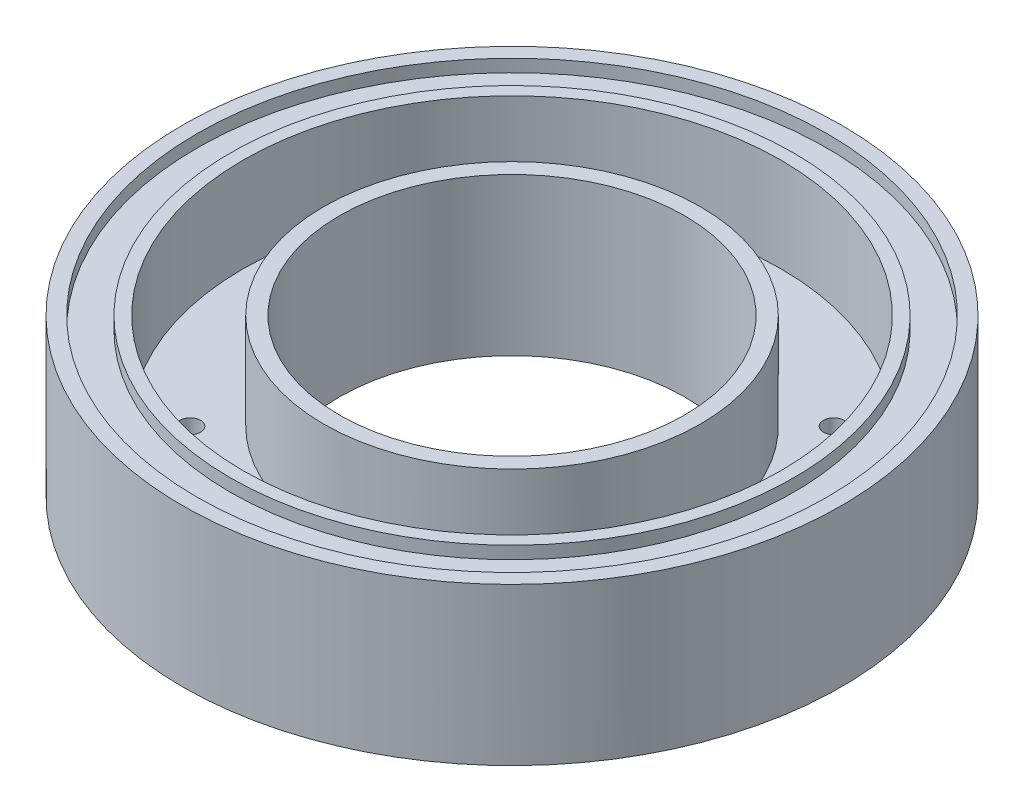
from build123d import *

# Parameters (mm, degrees)
SKETCH1_R           = 52.5
BOSS_EXTRUDE1_DEPTH = 30
SKETCH2_R           = 50.175
SKETCH2_R_2         = 44.85
CUT_EXTRUDE1_DEPTH  = 7
SKETCH3_R           = 42.85
SKETCH3_R_2         = 30
CUT_EXTRUDE2_DEPTH  = 20
SKETCH6_R           = 27.5
CUT_EXTRUDE6_DEPTH  = 81.07808689
SKETCH9_R           = 1.65
CUT_EXTRUDE7_DEPTH  = 10
SKETCH10_R          = 3
CUT_EXTRUDE8_DEPTH  = 4
SKETCH12_W          = 130.559751652
SKETCH12_H          = 125.592804578
CUT_EXTRUDE9_DEPTH  = 5
SKETCH13_R          = 43.441303223
SKETCH13_R_2        = 30
CUT_EXTRUDE10_DEPTH = 0.3


with BuildPart() as part:
    # Sketch1 → Boss-Extrude1 (new body)
    with BuildSketch(Plane(origin=(0, 0, 0), x_dir=(1, 0, 0), z_dir=(0, 1, 0))):
        Circle(SKETCH1_R)
    extrude(amount=BOSS_EXTRUDE1_DEPTH)

    # Sketch2 → Cut-Extrude1 (cut)
    with BuildSketch(Plane(origin=(0, 30, 0), x_dir=(1, 0, 0), z_dir=(0, 1, 0))):
        Circle(SKETCH2_R)
        Circle(SKETCH2_R_2, mode=Mode.SUBTRACT)
    extrude(amount=-CUT_EXTRUDE1_DEPTH, mode=Mode.SUBTRACT)

    # Sketch3 → Cut-Extrude2 (cut)
    with BuildSketch(Plane(origin=(0, 30, 0), x_dir=(1, 0, 0), z_dir=(0, 1, 0))):
        Circle(SKETCH3_R)
        Circle(SKETCH3_R_2, mode=Mode.SUBTRACT)
    extrude(amount=-CUT_EXTRUDE2_DEPTH, mode=Mode.SUBTRACT)

    # Sketch6 → Cut-Extrude6 (cut, through all)
    with BuildSketch(Plane(origin=(0, 30, 0), x_dir=(1, 0, 0), z_dir=(0, 1, 0))):
        Circle(SKETCH6_R)
    extrude(amount=-CUT_EXTRUDE6_DEPTH, mode=Mode.SUBTRACT)

    # Sketch9 → Cut-Extrude7 (cut)
    with BuildSketch(Plane.XZ):
        with Locations((-25.635, 25.635)):
            Circle(SKETCH9_R)
        with Locations((25.635, 25.635)):
            Circle(SKETCH9_R)
        with Locations((25.635, -25.635)):
            Circle(SKETCH9_R)
        with Locations((-25.635, -25.635)):
            Circle(SKETCH9_R)
    extrude(amount=-CUT_EXTRUDE7_DEPTH, mode=Mode.SUBTRACT)

    # Sketch10 → Cut-Extrude8 (cut)
    with BuildSketch(Plane.XZ):
        with Locations((-25.635, 25.635)):
            Circle(SKETCH10_R)
        with Locations((25.635, 25.635)):
            Circle(SKETCH10_R)
        with Locations((25.635, -25.635)):
            Circle(SKETCH10_R)
        with Locations((-25.635, -25.635)):
            Circle(SKETCH10_R)
    extrude(amount=-CUT_EXTRUDE8_DEPTH, mode=Mode.SUBTRACT)

    # Sketch12 → Cut-Extrude9 (cut)
    with BuildSketch(Plane(origin=(0, 30, 0), x_dir=(1, 0, 0), z_dir=(0, 1, 0))):
        Rectangle(SKETCH12_W, SKETCH12_H)
    extrude(amount=-CUT_EXTRUDE9_DEPTH, mode=Mode.SUBTRACT)

    # Sketch13 → Cut-Extrude10 (cut)
    with BuildSketch(Plane(origin=(0, 10, 0), x_dir=(1, 0, 0), z_dir=(0, 1, 0))):
        with Locations((-0.591303223, 0)):
            Circle(SKETCH13_R)
        Circle(SKETCH13_R_2, mode=Mode.SUBTRACT)
    extrude(amount=-CUT_EXTRUDE10_DEPTH, mode=Mode.SUBTRACT)


solid = part.part
